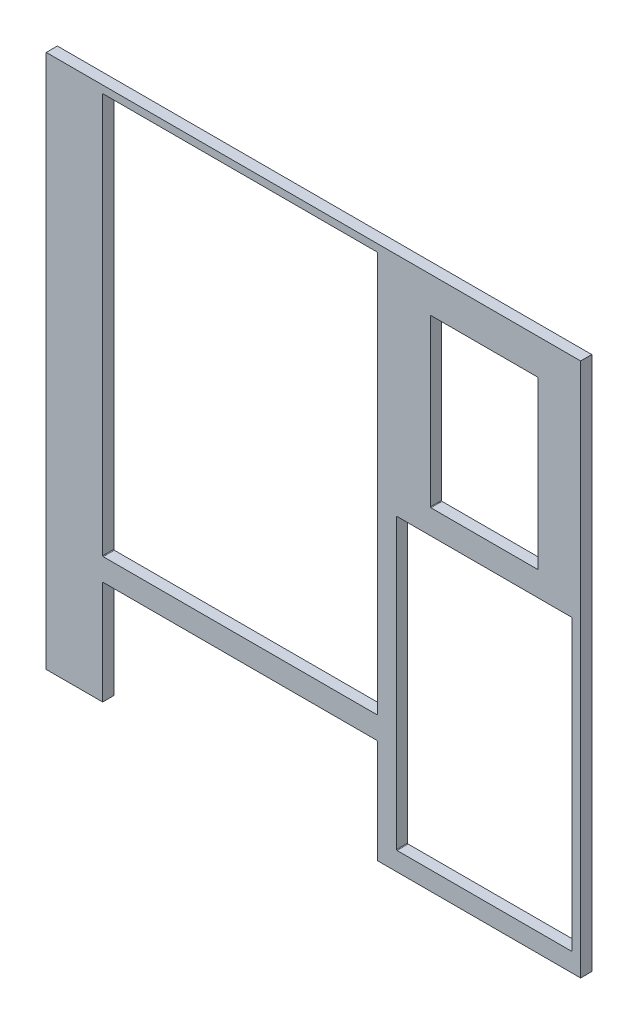
from build123d import *

# Parameters (mm, degrees)
SKETCH1_W           = 914.4
SKETCH1_H           = 914.4
BOSS_EXTRUDE1_DEPTH = 9.525
SKETCH2_W           = 184
SKETCH2_H           = 285
SKETCH2_W_2         = 300
SKETCH2_H_2         = 495
SKETCH2_W_3         = 469.9
SKETCH2_H_3         = 685.8
SKETCH2_H_4         = 177.8
CUT_EXTRUDE1_DEPTH  = 647.859012846
FILLET1_R           = 1


with BuildPart() as part:
    # Sketch1 → Boss-Extrude1 (new, symmetric)
    with BuildSketch(Plane.XY):
        Rectangle(SKETCH1_W, SKETCH1_H)
    extrude(amount=BOSS_EXTRUDE1_DEPTH, both=True)

    # Sketch2 → Cut-Extrude1 (cut, through all)
    with BuildSketch(Plane.XY.offset(9.525)):
        with Locations((292.1, 254)):
            Rectangle(SKETCH2_W, SKETCH2_H)
        with Locations((292.1, -177.8)):
            Rectangle(SKETCH2_W_2, SKETCH2_H_2)
        with Locations((-125.73, 101.6)):
            Rectangle(SKETCH2_W_3, SKETCH2_H_3)
        with Locations((-125.73, -368.3)):
            Rectangle(SKETCH2_W_3, SKETCH2_H_4)
    extrude(amount=-CUT_EXTRUDE1_DEPTH, mode=Mode.SUBTRACT)

    # Fillet1
    fillet1_edges = [part.edges().sort_by_distance(p)[0] for p in [
        (142.1, -425.3, 0),
        (142.1, 69.7, 0),
        (442.1, 69.7, 0),
        (442.1, -425.3, 0),
        (-360.68, -241.3, 0),
        (-360.68, 444.5, 0),
        (109.22, 444.5, 0),
        (109.22, -241.3, 0),
        (-360.68, -279.4, 0),
        (109.22, -279.4, 0),
        (200.1, 111.5, 0),
        (200.1, 396.5, 0),
        (384.1, 396.5, 0),
        (384.1, 111.5, 0),
    ]]
    fillet(fillet1_edges, radius=FILLET1_R)


solid = part.part
